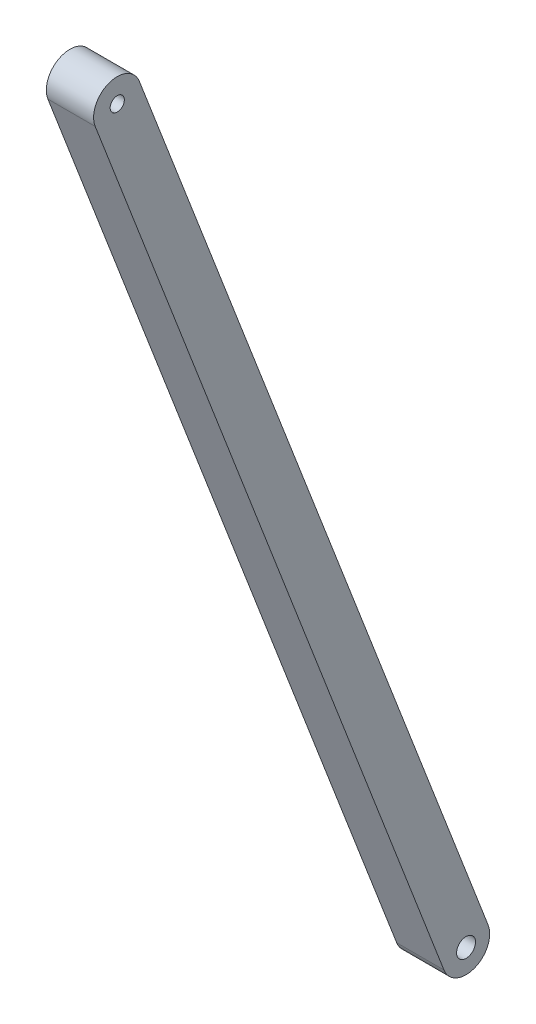
from build123d import *

# Parameters (mm, degrees)
BOSS_EXTRUDE1_DEPTH      = 5
BOSS_EXTRUDE1_DEPTH_BACK = 5
SKETCH2_R                = 1.5
SKETCH2_R_2              = 2


with BuildPart() as part:
    # Sketch2 → Boss-Extrude1 (new, two sides: drawn at the far end of the back side and taken through both)
    with BuildSketch(Plane(origin=(0, 0, 0), x_dir=(0, 0, -1), z_dir=(1, 0, 0)).offset(-BOSS_EXTRUDE1_DEPTH_BACK)):
        with BuildLine():
            Line((-37.711923347, -132.743444835), (-111.443355455, 58.568457266))
            ThreePointArc((-111.443355455, 58.568457266), (-108.575933735, 65.032039298), (-102.112351703, 62.164617578))
            Line((-102.112351703, 62.164617578), (-28.380919596, -129.147284523))
            ThreePointArc((-28.380919596, -129.147284523), (-31.248341316, -135.610866555), (-37.711923347, -132.743444835))
        make_face()
        with Locations((-106.777853579, 60.366537422)):
            Circle(SKETCH2_R, mode=Mode.SUBTRACT)
        with Locations((-33.046421472, -130.945364679)):
            Circle(SKETCH2_R_2, mode=Mode.SUBTRACT)
    extrude(amount=BOSS_EXTRUDE1_DEPTH + BOSS_EXTRUDE1_DEPTH_BACK)


solid = part.part
